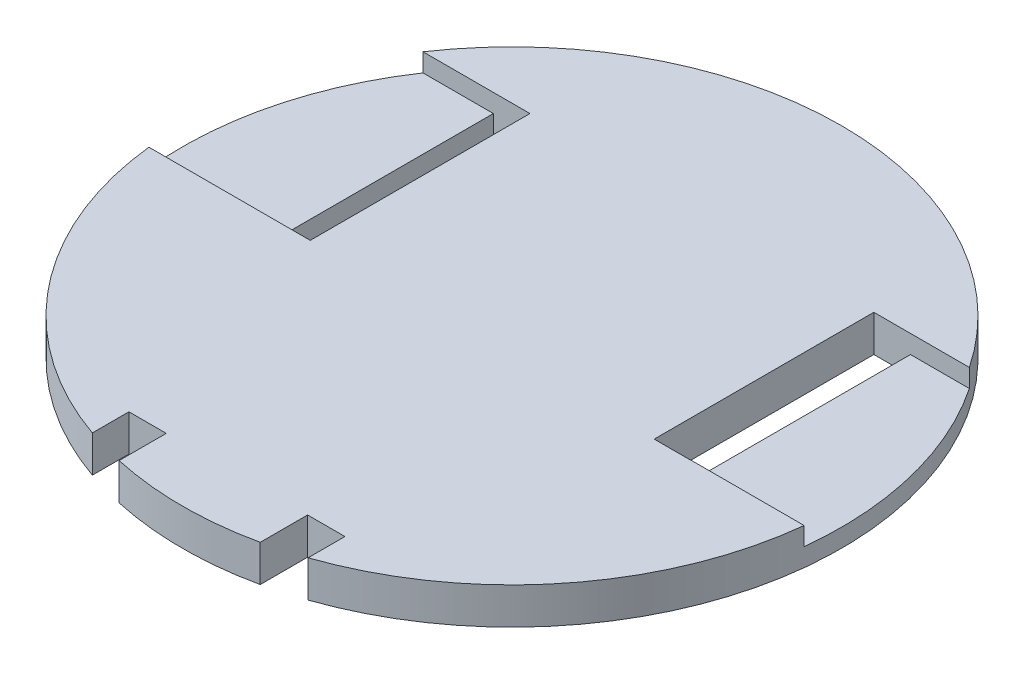
from build123d import *

# Parameters (mm, degrees)
SKETCH1_R           = 114.3
BOSS_EXTRUDE1_DEPTH = 12.7
SKETCH2_W           = 12.7
SKETCH2_H           = 76.2
BOSS_EXTRUDE2_DEPTH = 34.798
SKETCH3_W           = 12.7
SKETCH3_H           = 76.2
BOSS_EXTRUDE3_DEPTH = 28.740401289
CUT_EXTRUDE1_START  = -6.35
SKETCH4_W           = 28.393004938
SKETCH4_H           = 63.5
CUT_EXTRUDE1_DEPTH  = 6.35
SKETCH5_W           = 12.954
SKETCH5_H           = 12.954
CUT_EXTRUDE3_DEPTH  = 19.05


with BuildPart() as part:
    # Sketch1 → Boss-Extrude1 (new body)
    with BuildSketch(Plane(origin=(0, 0, 0), x_dir=(1, 0, 0), z_dir=(0, 1, 0))):
        with Locations(Location((-32.882992553, 35.040938939, 0), (0, 0, 270))):
            Circle(SKETCH1_R)
    extrude(amount=BOSS_EXTRUDE1_DEPTH)


with BuildPart() as body_2:
    # Sketch2 → Boss-Extrude2 (new body)
    with BuildSketch(Plane(origin=(-68.183595193, 12.7, 21.019137782), x_dir=(1, 0, 0), z_dir=(0, 1, 0))):
        with Locations((-28.710414214, 81.861212069)):
            Rectangle(SKETCH2_W, SKETCH2_H)
    extrude(amount=-BOSS_EXTRUDE2_DEPTH)


with BuildPart() as body_3:
    # Sketch3 → Boss-Extrude3 (new body)
    with BuildSketch(Plane(origin=(0, 12.7, 4.049059252), x_dir=(1, 0, 0), z_dir=(0, 1, 0))):
        with Locations((35.146495172, 64.834549154)):
            Rectangle(SKETCH3_W, SKETCH3_H)
    extrude(amount=-BOSS_EXTRUDE3_DEPTH)


with BuildPart() as part_1:
    add(part.part)

    # Combine1: cut body 2, body 3
    add(body_2.part, mode=Mode.SUBTRACT)
    add(body_3.part, mode=Mode.SUBTRACT)

    # Sketch4 → Cut-Extrude1 (cut)
    with BuildSketch(Plane(origin=(0, 12.7, 0), x_dir=(1, 0, 0), z_dir=(0, 1, 0)).offset(CUT_EXTRUDE1_START)):
        with BuildLine():
            ThreePointArc((81.417007447, 35.040938939), (78.08126298, 62.45305294), (68.268731087, 88.265170308))
            Line((68.268731087, 88.265170308), (41.496495172, 88.265170308))
            Line((41.496495172, 88.265170308), (41.496495172, 24.765170308))
            Line((41.496495172, 24.765170308), (80.954165612, 24.765170308))
            ThreePointArc((80.954165612, 24.765170308), (81.30123836, 29.897845426), (81.417007447, 35.040938939))
        make_face()
        with BuildLine():
            Line((84.866092825, 88.265170308), (68.268731087, 88.265170308))
            ThreePointArc((68.268731087, 88.265170308), (78.08126298, 62.45305294), (81.417007447, 35.040938939))
            ThreePointArc((81.417007447, 35.040938939), (81.30123836, 29.897845426), (80.954165612, 24.765170308))
            Line((80.954165612, 24.765170308), (84.866092825, 24.765170308))
            Line((84.866092825, 24.765170308), (84.866092825, 88.265170308))
        make_face()
        with Locations((-117.440511876, 60.842074288)):
            Rectangle(SKETCH4_W, SKETCH4_H)
        with BuildLine():
            Line((-131.637014345, 29.092074288), (-131.637014345, 92.592074288))
            ThreePointArc((-131.637014345, 92.592074288), (-143.966610555, 61.96527387), (-147.028080092, 29.092074288))
            Line((-147.028080092, 29.092074288), (-131.637014345, 29.092074288))
        make_face()
        with BuildLine():
            Line((-103.244009407, 29.092074288), (-131.637014345, 29.092074288))
            Line((-131.637014345, 29.092074288), (-147.028080092, 29.092074288))
            ThreePointArc((-147.028080092, 29.092074288), (-146.817975763, 25.913529623), (-146.519377256, 22.742074288))
            Line((-146.519377256, 22.742074288), (-103.244009407, 22.742074288))
            Line((-103.244009407, 22.742074288), (-103.244009407, 29.092074288))
        make_face()
        with BuildLine():
            ThreePointArc((-127.651842399, 98.942074288), (-129.696504455, 95.799756515), (-131.637014345, 92.592074288))
            Line((-131.637014345, 92.592074288), (-103.244009407, 92.592074288))
            Line((-103.244009407, 92.592074288), (-103.244009407, 98.942074288))
            Line((-103.244009407, 98.942074288), (-127.651842399, 98.942074288))
        make_face()
        with BuildLine():
            Line((41.496495172, 22.742074288), (80.75339215, 22.742074288))
            ThreePointArc((80.75339215, 22.742074288), (80.858277027, 23.753175898), (80.954165612, 24.765170308))
            Line((80.954165612, 24.765170308), (41.496495172, 24.765170308))
            Line((41.496495172, 24.765170308), (41.496495172, 22.742074288))
        make_face()
        with BuildLine():
            ThreePointArc((68.268731087, 88.265170308), (65.240150005, 93.661233159), (61.923986686, 98.885489901))
            Line((61.923986686, 98.885489901), (41.496495172, 98.885489901))
            Line((41.496495172, 98.885489901), (41.496495172, 88.265170308))
            Line((41.496495172, 88.265170308), (68.268731087, 88.265170308))
        make_face()
    extrude(amount=CUT_EXTRUDE1_DEPTH, mode=Mode.SUBTRACT)

    # Sketch5 → Cut-Extrude3 (cut)
    with BuildSketch(Plane.XY.offset(79.259061061)):
        with Locations((-64.02495724, 6.223)):
            Rectangle(SKETCH5_W, SKETCH5_H)
        with Locations((-2.04895724, 6.223)):
            Rectangle(SKETCH5_W, SKETCH5_H)
    extrude(amount=-CUT_EXTRUDE3_DEPTH, mode=Mode.SUBTRACT)


solid = part_1.part
